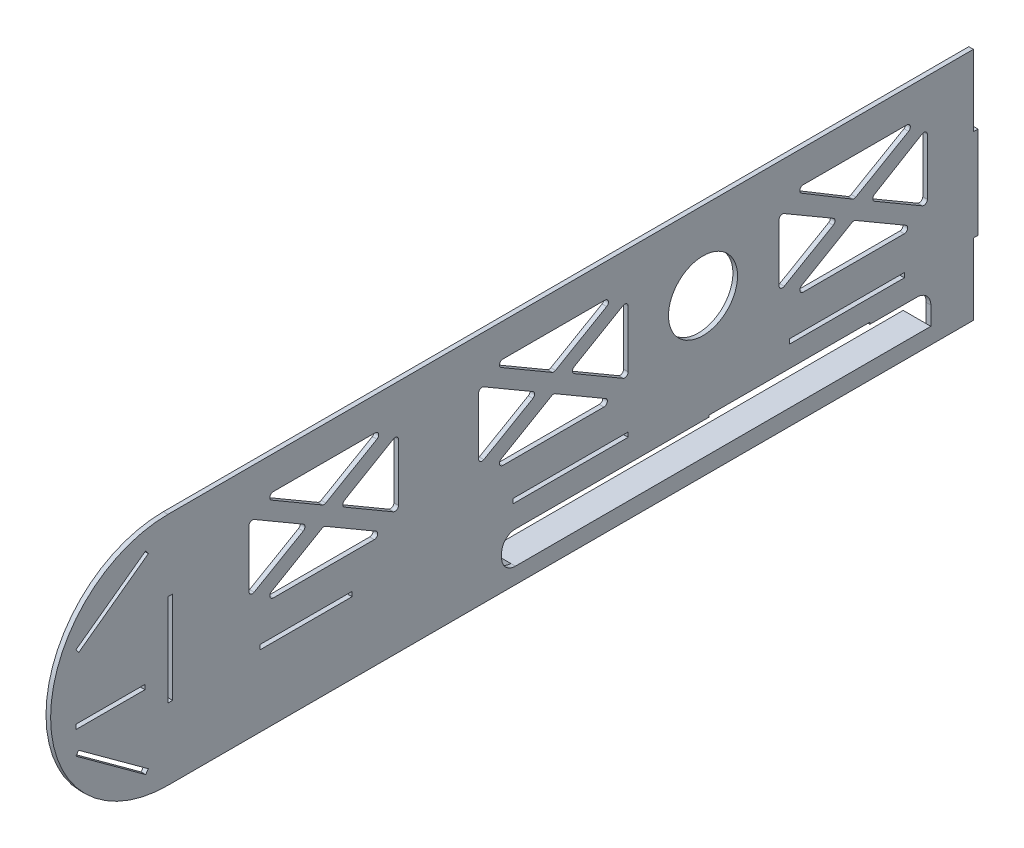
from build123d import *

# Parameters (mm, degrees)
SKETCH_1_W      = 40
SKETCH_1_H      = 2
SKETCH_1_W_2    = 50
SKETCH_1_R      = 15
SKETCH_1_W_3    = 30
SKETCH_1_W_4    = 2
SKETCH_1_H_2    = 40
EXTRUDE_3_DEPTH = 2
SKETCH_2_W      = 180.5
SKETCH_2_H      = 7
EXTRUDE_4_DEPTH = 12


with BuildPart() as part:
    # 草图1 → 凸台-拉伸3 (new body)
    # profile 1 of 4: a face of its own
    with BuildSketch(Plane(origin=(0, 0, 0), x_dir=(0, 0, -1), z_dir=(1, 0, 0))):
        Polygon((139, 51), (0, 51), (0, 20), (2, 20), (2, -20), (0, -20), (0, -51), (350, -51), (350, -20), (350, 20), (350, 51), (337.5, 51), (331.5, 51), (145, 51), align=None)
        with Locations((59.999999544, -18.999999639)):
            Rectangle(SKETCH_1_W, SKETCH_1_H, mode=Mode.SUBTRACT)
        with BuildLine():
            Line((145, -38), (145, -36))
            ThreePointArc((145, -36), (146.757359313, -31.757359313), (151, -30))
            Line((151, -30), (235, -30))
            Line((235, -30), (235, -29.2))
            Line((235, -29.2), (305, -29.2))
            Line((305, -29.2), (305, -30))
            Line((305, -30), (325.5, -30))
            ThreePointArc((325.5, -30), (329.742640687, -31.757359313), (331.5, -36))
            Line((331.5, -36), (331.5, -39))
            Line((331.5, -39), (331.5, -44))
            Line((331.5, -44), (325.5, -44))
            Line((325.5, -44), (151, -44))
            ThreePointArc((151, -44), (146.757359313, -42.242640687), (145, -38))
        make_face(mode=Mode.SUBTRACT)
        with Locations((174.999999544, -18.999999639)):
            Rectangle(SKETCH_1_W_2, SKETCH_1_H, mode=Mode.SUBTRACT)
        with Locations((294.999999544, -18.999999639)):
            Rectangle(SKETCH_1_W_2, SKETCH_1_H, mode=Mode.SUBTRACT)
        with BuildLine():
            Line((35.191745107, 4.260800891), (35.191745107, 29.047933032))
            ThreePointArc((35.191745107, 29.047933032), (35.944654017, 30.348646261), (37.447551645, 30.343601384))
            Line((37.447551645, 30.343601384), (58.776761499, 17.901562302))
            ThreePointArc((58.776761499, 17.901562302), (59.520952796, 16.603345479), (58.772354511, 15.307664881))
            Line((58.772354511, 15.307664881), (37.443144656, 2.962571821))
            ThreePointArc((37.443144656, 2.962571821), (35.942445208, 2.961358833), (35.191745107, 4.260800891))
        make_face(mode=Mode.SUBTRACT)
        with BuildLine():
            Line((89.643364252, -3.340511469), (45.740125962, -3.340511469))
            ThreePointArc((45.740125962, -3.340511469), (44.292109641, -2.231981438), (44.984319423, -0.544843118))
            Line((44.984319423, -0.544843118), (66.935938568, 12.26026805))
            ThreePointArc((66.935938568, 12.26026805), (67.691745107, 12.464599699), (68.447551645, 12.26026805))
            Line((68.447551645, 12.26026805), (90.39917079, -0.544843118))
            ThreePointArc((90.39917079, -0.544843118), (91.091380572, -2.231981438), (89.643364252, -3.340511469))
        make_face(mode=Mode.SUBTRACT)
        with BuildLine():
            ThreePointArc((97.935938568, 30.343601384), (99.438836196, 30.348646261), (100.191745107, 29.047933032))
            Line((100.191745107, 29.047933032), (100.191745107, 4.27104403))
            ThreePointArc((100.191745107, 4.27104403), (99.438836196, 2.970330801), (97.935938568, 2.975375678))
            Line((97.935938568, 2.975375678), (76.698605138, 15.36382018))
            ThreePointArc((76.698605138, 15.36382018), (75.954411676, 16.659488531), (76.698605138, 17.955156882))
            Line((76.698605138, 17.955156882), (97.935938568, 30.343601384))
        make_face(mode=Mode.SUBTRACT)
        with BuildLine():
            Line((134.999999544, 4.260800891), (134.999999544, 29.047933032))
            ThreePointArc((134.999999544, 29.047933032), (135.752908454, 30.348646261), (137.255806082, 30.343601384))
            Line((137.255806082, 30.343601384), (158.585015936, 17.901562302))
            ThreePointArc((158.585015936, 17.901562302), (159.329207233, 16.603345479), (158.580608948, 15.307664881))
            Line((158.580608948, 15.307664881), (137.251399093, 2.962571821))
            ThreePointArc((137.251399093, 2.962571821), (135.750699645, 2.961358833), (134.999999544, 4.260800891))
        make_face(mode=Mode.SUBTRACT)
        with BuildLine():
            ThreePointArc((44.984319423, 33.86382018), (44.292109641, 35.5509585), (45.740125962, 36.659488531))
            Line((45.740125962, 36.659488531), (90.076890905, 36.659488531))
            ThreePointArc((90.076890905, 36.659488531), (91.525570236, 35.548497783), (90.828290455, 33.861259462))
            Line((90.828290455, 33.861259462), (68.573204266, 20.980280188))
            ThreePointArc((68.573204266, 20.980280188), (67.819256245, 20.778511422), (67.065998178, 20.982840906))
            Line((67.065998178, 20.982840906), (44.984319423, 33.86382018))
        make_face(mode=Mode.SUBTRACT)
        with BuildLine():
            Line((189.451618689, -3.340511469), (145.548380399, -3.340511469))
            ThreePointArc((145.548380399, -3.340511469), (144.100364078, -2.231981438), (144.79257386, -0.544843118))
            Line((144.79257386, -0.544843118), (166.744193005, 12.26026805))
            ThreePointArc((166.744193005, 12.26026805), (167.499999544, 12.464599699), (168.255806082, 12.26026805))
            Line((168.255806082, 12.26026805), (190.207425227, -0.544843118))
            ThreePointArc((190.207425227, -0.544843118), (190.899635009, -2.231981438), (189.451618689, -3.340511469))
        make_face(mode=Mode.SUBTRACT)
        with BuildLine():
            ThreePointArc((197.744193005, 30.684113214), (199.247090633, 30.689158091), (199.999999544, 29.388444862))
            Line((199.999999544, 29.388444862), (199.999999544, 4.61155586))
            ThreePointArc((199.999999544, 4.61155586), (199.247090633, 3.310842631), (197.744193005, 3.315887508))
            Line((197.744193005, 3.315887508), (176.506859575, 15.70433201))
            ThreePointArc((176.506859575, 15.70433201), (175.762666113, 17.000000361), (176.506859575, 18.295668712))
            Line((176.506859575, 18.295668712), (197.744193005, 30.684113214))
        make_face(mode=Mode.SUBTRACT)
        with Locations((232.499999544, 17.000000361)):
            Circle(SKETCH_1_R, mode=Mode.SUBTRACT)
        with BuildLine():
            Line((319.974166341, -3.394327578), (276.070928051, -3.394327578))
            ThreePointArc((276.070928051, -3.394327578), (274.622911731, -2.285797546), (275.315121513, -0.598659226))
            Line((275.315121513, -0.598659226), (297.266740658, 12.206451942))
            ThreePointArc((297.266740658, 12.206451942), (298.022547196, 12.41078359), (298.778353734, 12.206451942))
            Line((298.778353734, 12.206451942), (320.729972879, -0.598659226))
            ThreePointArc((320.729972879, -0.598659226), (321.422182661, -2.285797546), (319.974166341, -3.394327578))
        make_face(mode=Mode.SUBTRACT)
        with BuildLine():
            Line((265.522547196, 4.206984782), (265.522547196, 28.994116924))
            ThreePointArc((265.522547196, 28.994116924), (266.275456106, 30.294830153), (267.778353734, 30.289785275))
            Line((267.778353734, 30.289785275), (289.107563589, 17.847746193))
            ThreePointArc((289.107563589, 17.847746193), (289.851754885, 16.549529371), (289.1031566, 15.253848773))
            Line((289.1031566, 15.253848773), (267.773946745, 2.908755713))
            ThreePointArc((267.773946745, 2.908755713), (266.273247297, 2.907542724), (265.522547196, 4.206984782))
        make_face(mode=Mode.SUBTRACT)
        with BuildLine():
            ThreePointArc((327.730104048, 30.281463391), (329.239984934, 30.298885724), (329.999999544, 28.994116924))
            Line((329.999999544, 28.994116924), (329.999999544, 4.522047385))
            ThreePointArc((329.999999544, 4.522047385), (329.247090633, 3.221334156), (327.744193005, 3.226379034))
            Line((327.744193005, 3.226379034), (307.029407227, 15.310004071))
            ThreePointArc((307.029407227, 15.310004071), (306.285236078, 16.597490851), (307.01531827, 17.893018889))
            Line((307.01531827, 17.893018889), (327.730104048, 30.281463391))
        make_face(mode=Mode.SUBTRACT)
        with BuildLine():
            ThreePointArc((144.79257386, 33.86382018), (144.100364078, 35.5509585), (145.548380399, 36.659488531))
            Line((145.548380399, 36.659488531), (189.885145343, 36.659488531))
            ThreePointArc((189.885145343, 36.659488531), (191.333824673, 35.548497783), (190.636544892, 33.861259462))
            Line((190.636544892, 33.861259462), (168.381458703, 20.980280188))
            ThreePointArc((168.381458703, 20.980280188), (167.627510682, 20.778511422), (166.874252615, 20.982840906))
            Line((166.874252615, 20.982840906), (144.79257386, 33.86382018))
        make_face(mode=Mode.SUBTRACT)
        with BuildLine():
            ThreePointArc((275.298058871, 34.214436971), (274.625531032, 35.901033349), (276.070928051, 37.000000361))
            Line((276.070928051, 37.000000361), (321.088992302, 37.000000361))
            ThreePointArc((321.088992302, 37.000000361), (322.537671633, 35.889009613), (321.840391852, 34.201771291))
            Line((321.840391852, 34.201771291), (298.904006355, 20.926464079))
            ThreePointArc((298.904006355, 20.926464079), (298.140143214, 20.72474493), (297.379737626, 20.939129758))
            Line((297.379737626, 20.939129758), (275.298058871, 34.214436971))
        make_face(mode=Mode.SUBTRACT)
    # profile 2 of 4: a face of its own
    with BuildSketch(Plane(origin=(0, 0, 0), x_dir=(0, 0, -1), z_dir=(1, 0, 0))):
        with BuildLine():
            Line((0, 20), (0, 51))
            ThreePointArc((0, 51), (-36.062445841, 36.062445841), (-51, 0))
            Line((-51, 0), (0, 0))
            Line((0, 0), (0, 20))
        make_face()
        Polygon((-38.821768829, 18.383902445), (-40, 20), (-9.698170842, 42.091834457), (-8.519939671, 40.475736902), align=None, mode=Mode.SUBTRACT)
    # profile 3 of 4: a face of its own
    with BuildSketch(Plane(origin=(0, 0, 0), x_dir=(0, 0, -1), z_dir=(1, 0, 0))):
        with BuildLine():
            Line((0, 0), (-51, 0))
            ThreePointArc((-51, 0), (-36.062445841, -36.062445841), (0, -51))
            Line((0, -51), (0, -20))
            Line((0, -20), (0, 0))
        make_face()
        Polygon((-40, -20), (-38.821768829, -18.383902445), (-8.519939671, -40.475736902), (-9.698170842, -42.091834457), align=None, mode=Mode.SUBTRACT)
        with Locations((-25, -9)):
            Rectangle(SKETCH_1_W_3, SKETCH_1_H, mode=Mode.SUBTRACT)
    # profile 4 of 4: a face of its own
    with BuildSketch(Plane(origin=(0, 0, 0), x_dir=(0, 0, -1), z_dir=(1, 0, 0))):
        with Locations((351, 0)):
            Rectangle(SKETCH_1_W_4, SKETCH_1_H_2)
    extrude(amount=EXTRUDE_3_DEPTH)

    # 草图2 → 凸台-拉伸4 (add)
    with BuildSketch(Plane(origin=(2, 0, 0), x_dir=(0, 0, -1), z_dir=(1, 0, 0))):
        with Locations((241.25, -47.5)):
            Rectangle(SKETCH_2_W, SKETCH_2_H)
        Polygon((151, -30), (235, -30), (235, -29.2), (305, -29.2), (305, -30), (325.5, -30), (325.5, -25), (151, -25), align=None)
    extrude(amount=-EXTRUDE_4_DEPTH)


solid = part.part
